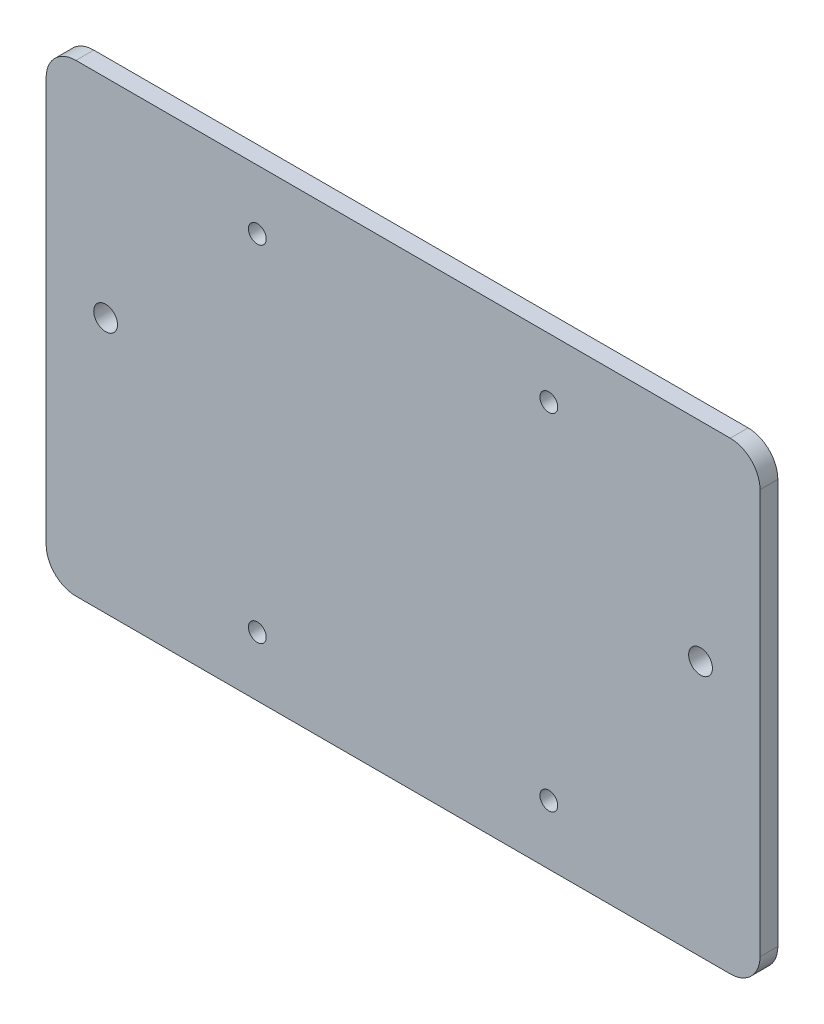
from build123d import *

# Parameters (mm, degrees)
SKETCH_1_R      = 1.5
SKETCH_1_R_2    = 2
EXTRUDE_1_DEPTH = 3


with BuildPart() as part:
    # 草圖1 → 填料-伸長1 (new body)
    with BuildSketch(Plane.XY):
        with BuildLine():
            Line((-55, 39), (55, 39))
            ThreePointArc((55, 39), (58.535533906, 37.535533906), (60, 34))
            Line((60, 34), (60, -34))
            ThreePointArc((60, -34), (58.535533906, -37.535533906), (55, -39))
            Line((55, -39), (-55, -39))
            ThreePointArc((-55, -39), (-58.535533906, -37.535533906), (-60, -34))
            Line((-60, -34), (-60, 34))
            ThreePointArc((-60, 34), (-58.535533906, 37.535533906), (-55, 39))
        make_face()
        with Locations((-24.5, 29)):
            Circle(SKETCH_1_R, mode=Mode.SUBTRACT)
        with Locations((24.5, 29)):
            Circle(SKETCH_1_R, mode=Mode.SUBTRACT)
        with Locations((-24.5, -29)):
            Circle(SKETCH_1_R, mode=Mode.SUBTRACT)
        with Locations((24.5, -29)):
            Circle(SKETCH_1_R, mode=Mode.SUBTRACT)
        with Locations((50, 4)):
            Circle(SKETCH_1_R_2, mode=Mode.SUBTRACT)
        with Locations(Location((-50, 4, 0), (0, 0, 180))):
            Circle(SKETCH_1_R_2, mode=Mode.SUBTRACT)
    extrude(amount=EXTRUDE_1_DEPTH)


solid = part.part
